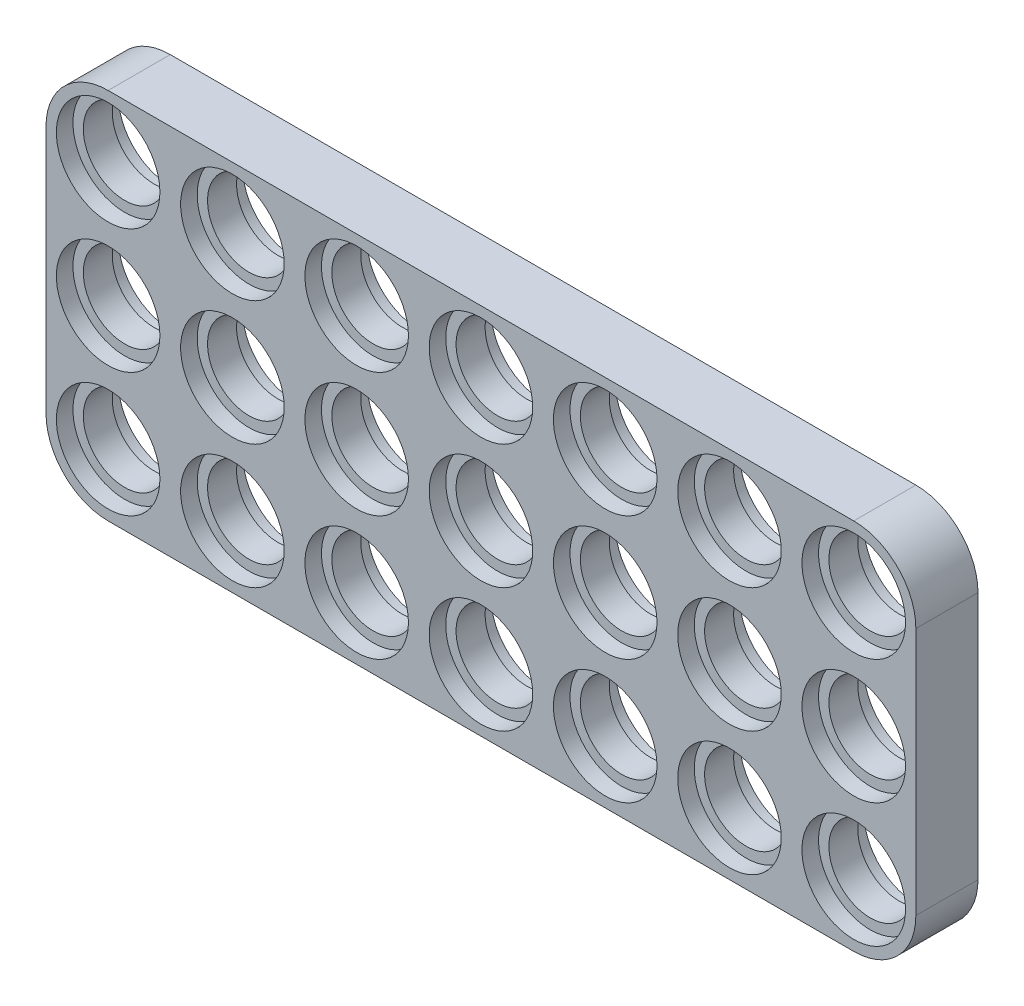
from build123d import *

# Parameters (mm, degrees)
SKETCH1_W           = 6
SKETCH1_H           = 6
BOSS_EXTRUDE1_DEPTH = 3
HOLE1_D             = 4
HOLE1_DEPTH         = 3
HOLE1_CBORE_D       = 5
HOLE1_CBORE_DEPTH   = 0.8
HOLE1_TIP           = 1.201721238
CUT_EXTRUDE1_START  = -0.8
SKETCH4_R           = 2.5
CUT_EXTRUDE1_DEPTH  = 0.8
LPATTERN1_COUNT     = 3
LPATTERN1_PITCH     = 6
LPATTERN1_2_COUNT   = 7
LPATTERN1_2_PITCH   = 6
FILLET5_R           = 3


with BuildPart() as part:
    # Sketch1 → Boss-Extrude1 (new body)
    with BuildSketch(Plane.XY):
        with Locations((-3, 3)):
            Rectangle(SKETCH1_W, SKETCH1_H)
    extrude(amount=BOSS_EXTRUDE1_DEPTH)

    # Hole1
    with Locations(Plane.XY.offset(3)):
        with Locations((-3, 3)):
            CounterBoreHole(HOLE1_D / 2, HOLE1_CBORE_D / 2, HOLE1_CBORE_DEPTH, depth=HOLE1_DEPTH)
            with Locations((0, 0, -(HOLE1_DEPTH + HOLE1_TIP / 2))):  # 118° drill point
                Cone(0, HOLE1_D / 2, HOLE1_TIP, mode=Mode.SUBTRACT)

    # Sketch4 → Cut-Extrude1 (cut)
    with BuildSketch(Plane(origin=(0, 0, 0), x_dir=(-1, 0, 0), z_dir=(0, 0, -1)).offset(CUT_EXTRUDE1_START)):
        with Locations(Location((3, 3, 0), (0, 0, 180))):
            Circle(SKETCH4_R)
    extrude(amount=CUT_EXTRUDE1_DEPTH, mode=Mode.SUBTRACT)


with BuildPart() as lpattern1_1:
    # LPattern1: pattern copy
    add(part.part.moved(Location(Vector(0, 1, 0) * (1 * LPATTERN1_PITCH))))


with BuildPart() as lpattern1_2:
    # LPattern1: pattern copy
    add(part.part.moved(Location(Vector(0, 1, 0) * (2 * LPATTERN1_PITCH))))


with BuildPart() as lpattern1_2_1:
    # LPattern1 2: pattern copy
    add(part.part.moved(Location(Vector(1, 0, 0) * (1 * LPATTERN1_2_PITCH))))


with BuildPart() as lpattern1_2_2:
    # LPattern1 2: pattern copy
    add(part.part.moved(Location(Vector(1, 0, 0) * (2 * LPATTERN1_2_PITCH))))


with BuildPart() as lpattern1_2_3:
    # LPattern1 2: pattern copy
    add(part.part.moved(Location(Vector(1, 0, 0) * (3 * LPATTERN1_2_PITCH))))


with BuildPart() as lpattern1_2_4:
    # LPattern1 2: pattern copy
    add(part.part.moved(Location(Vector(1, 0, 0) * (4 * LPATTERN1_2_PITCH))))


with BuildPart() as lpattern1_2_5:
    # LPattern1 2: pattern copy
    add(part.part.moved(Location(Vector(1, 0, 0) * (5 * LPATTERN1_2_PITCH))))


with BuildPart() as lpattern1_2_6:
    # LPattern1 2: pattern copy
    add(part.part.moved(Location(Vector(1, 0, 0) * (6 * LPATTERN1_2_PITCH))))


with BuildPart() as lpattern1_2_7:
    # LPattern1 2: pattern copy
    add(lpattern1_1.part.moved(Location(Vector(1, 0, 0) * (1 * LPATTERN1_2_PITCH))))


with BuildPart() as lpattern1_2_8:
    # LPattern1 2: pattern copy
    add(lpattern1_1.part.moved(Location(Vector(1, 0, 0) * (2 * LPATTERN1_2_PITCH))))


with BuildPart() as lpattern1_2_9:
    # LPattern1 2: pattern copy
    add(lpattern1_1.part.moved(Location(Vector(1, 0, 0) * (3 * LPATTERN1_2_PITCH))))


with BuildPart() as lpattern1_2_10:
    # LPattern1 2: pattern copy
    add(lpattern1_1.part.moved(Location(Vector(1, 0, 0) * (4 * LPATTERN1_2_PITCH))))


with BuildPart() as lpattern1_2_11:
    # LPattern1 2: pattern copy
    add(lpattern1_1.part.moved(Location(Vector(1, 0, 0) * (5 * LPATTERN1_2_PITCH))))


with BuildPart() as lpattern1_2_12:
    # LPattern1 2: pattern copy
    add(lpattern1_1.part.moved(Location(Vector(1, 0, 0) * (6 * LPATTERN1_2_PITCH))))


with BuildPart() as lpattern1_2_13:
    # LPattern1 2: pattern copy
    add(lpattern1_2.part.moved(Location(Vector(1, 0, 0) * (1 * LPATTERN1_2_PITCH))))


with BuildPart() as lpattern1_2_14:
    # LPattern1 2: pattern copy
    add(lpattern1_2.part.moved(Location(Vector(1, 0, 0) * (2 * LPATTERN1_2_PITCH))))


with BuildPart() as lpattern1_2_15:
    # LPattern1 2: pattern copy
    add(lpattern1_2.part.moved(Location(Vector(1, 0, 0) * (3 * LPATTERN1_2_PITCH))))


with BuildPart() as lpattern1_2_16:
    # LPattern1 2: pattern copy
    add(lpattern1_2.part.moved(Location(Vector(1, 0, 0) * (4 * LPATTERN1_2_PITCH))))


with BuildPart() as lpattern1_2_17:
    # LPattern1 2: pattern copy
    add(lpattern1_2.part.moved(Location(Vector(1, 0, 0) * (5 * LPATTERN1_2_PITCH))))


with BuildPart() as lpattern1_2_18:
    # LPattern1 2: pattern copy
    add(lpattern1_2.part.moved(Location(Vector(1, 0, 0) * (6 * LPATTERN1_2_PITCH))))


with BuildPart() as part_1:
    add(part.part)

    # Combine3: union LPattern1_1, LPattern1_2, LPattern1 2_1, LPattern1 2_7, LPattern1 2_13, LPattern1 2_2, LPattern1 2_8, LPattern1 2_14, LPattern1 2_3, LPattern1 2_9, LPattern1 2_15, LPattern1 2_4, LPattern1 2_10, LPattern1 2_16, LPattern1 2_5, LPattern1 2_11, LPattern1 2_17, LPattern1 2_6, LPattern1 2_12, LPattern1 2_18
    add(lpattern1_1.part)
    add(lpattern1_2.part)
    add(lpattern1_2_1.part)
    add(lpattern1_2_7.part)
    add(lpattern1_2_13.part)
    add(lpattern1_2_2.part)
    add(lpattern1_2_8.part)
    add(lpattern1_2_14.part)
    add(lpattern1_2_3.part)
    add(lpattern1_2_9.part)
    add(lpattern1_2_15.part)
    add(lpattern1_2_4.part)
    add(lpattern1_2_10.part)
    add(lpattern1_2_16.part)
    add(lpattern1_2_5.part)
    add(lpattern1_2_11.part)
    add(lpattern1_2_17.part)
    add(lpattern1_2_6.part)
    add(lpattern1_2_12.part)
    add(lpattern1_2_18.part)

    # Fillet5
    fillet5_edges = [part_1.edges().sort_by_distance(p)[0] for p in [
        (-6, 18, 1.5),
        (36, 18, 1.5),
        (36, 0, 1.5),
        (-6, 0, 1.5),
    ]]
    fillet(fillet5_edges, radius=FILLET5_R)


solid = part_1.part
